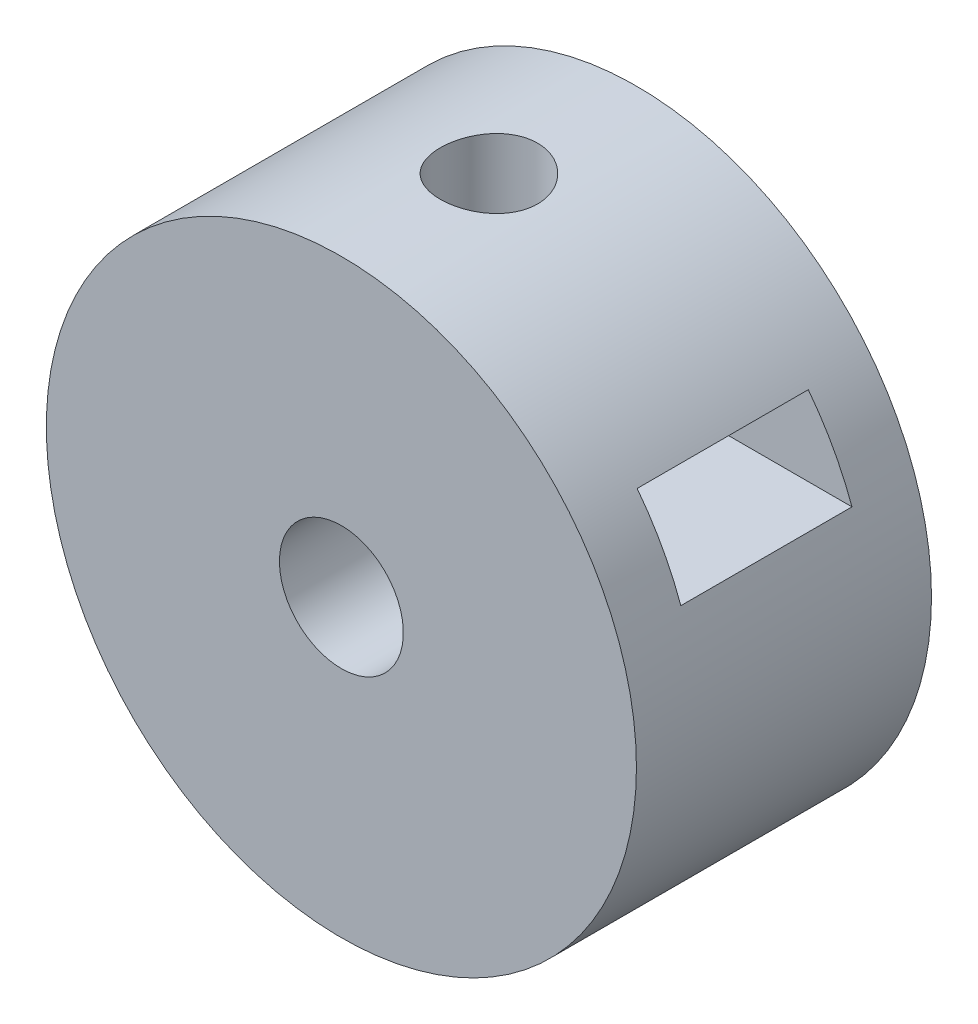
from build123d import *

# Parameters (mm, degrees)
SKETCH_1_R          = 10
EXTRUDE_1_DEPTH     = 10
SKETCH_2_R          = 2.1
CUT_EXTRUDE_2_DEPTH = 10
CUT_EXTRUDE_3_DEPTH = 10
SKETCH_5_R          = 1.65
CUT_EXTRUDE_4_DEPTH = 10
CUT_EXTRUDE_START   = -3.9
CUT_EXTRUDE_5_DEPTH = 2.7


with BuildPart() as part:
    # Эскиз1 → Бобышка-Вытянуть1 (new body)
    with BuildSketch(Plane.XY):
        Circle(SKETCH_1_R)
    extrude(amount=EXTRUDE_1_DEPTH)

    # Эскиз2 → Вырез-Вытянуть2 (cut)
    with BuildSketch(Plane(origin=(0, 0, 0), x_dir=(-1, 0, 0), z_dir=(0, 0, -1))):
        Circle(SKETCH_2_R)
    extrude(amount=-CUT_EXTRUDE_2_DEPTH, mode=Mode.SUBTRACT)

    # Sketch 4 → Вырез-Вытянуть3 (cut)
    with BuildSketch(Plane(origin=(10, 6.1, 7.9), x_dir=(0, -0.42202958015785924, -0.9065820610798457), z_dir=(1, 0, 0))):
        Polygon((0, 0), (5.258175954, 2.447771565), (6.397655821, 0), (1.139479866, -2.447771565), align=None)
    extrude(amount=-CUT_EXTRUDE_3_DEPTH, mode=Mode.SUBTRACT)

    # Эскиз5 → Вырез-Вытянуть4 (cut)
    with BuildSketch(Plane(origin=(0, 10, 0), x_dir=(1, 0, 0), z_dir=(0, 1, 0))):
        with Locations(Location((0, -5, 0), (0, 0, 270))):
            Circle(SKETCH_5_R)
    extrude(amount=-CUT_EXTRUDE_4_DEPTH, mode=Mode.SUBTRACT)

    # Эскиз6 → Вырез-Вытянуть5 (cut)
    with BuildSketch(Plane(origin=(0, 10, 0), x_dir=(1, 0, 0), z_dir=(0, 1, 0)).offset(CUT_EXTRUDE_START)):
        Polygon((-1.674315781, -2.1), (-3.348631561, -5), (-1.674315781, -7.9), (1.674315781, -7.9), (3.348631561, -5), (1.674315781, -2.1), align=None)
    extrude(amount=-CUT_EXTRUDE_5_DEPTH, mode=Mode.SUBTRACT)


solid = part.part
